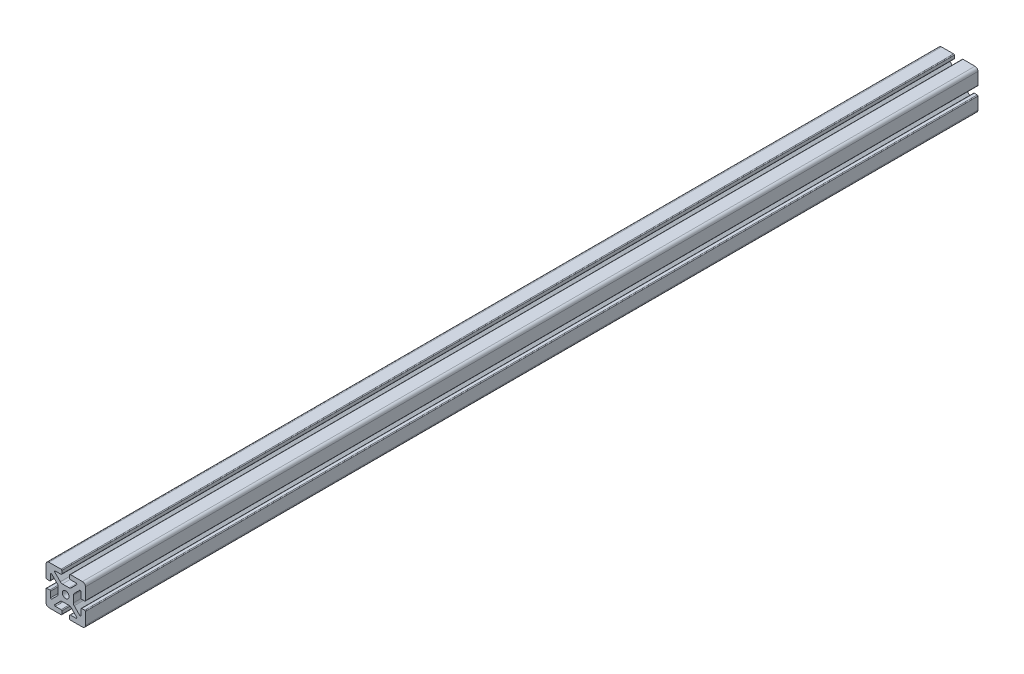
from build123d import *

# Parameters (mm, degrees)
SKETCH1_R          = 3.4036
EXTRUDE1_DEPTH     = 635
CUT_EXTRUDE1_REACH = 638.389
SKETCH4_W          = 58.501723951
SKETCH4_H          = 389.38319937
SKETCH5_W          = 40
SKETCH5_H          = 364.5
CUT_EXTRUDE2_DEPTH = 3.048


with BuildPart() as part:
    # Sketch1 → Extrude1 (new, symmetric)
    with BuildSketch(Plane.XY):
        with BuildLine():
            Line((-20, 16.952), (-20, 4.7625))
            ThreePointArc((-20, 4.7625), (-19.776815367, 4.223684633), (-19.238, 4.0005))
            Line((-19.238, 4.0005), (-16.2662, 4.0005))
            ThreePointArc((-16.2662, 4.0005), (-15.727384633, 4.223684633), (-15.5042, 4.7625))
            Line((-15.5042, 4.7625), (-15.5042, 10.485558599))
            ThreePointArc((-15.5042, 10.485558599), (-15.033804775, 11.189554802), (-14.203384633, 11.024373966))
            Line((-14.203384633, 11.024373966), (-8.635059555, 5.456048889))
            ThreePointArc((-8.635059555, 5.456048889), (-7.985348265, 4.483687227), (-7.7572, 3.336708444))
            Line((-7.7572, 3.336708444), (-7.7572, -3.336708444))
            ThreePointArc((-7.7572, -3.336708444), (-7.985348265, -4.483687227), (-8.635059555, -5.456048889))
            Line((-8.635059555, -5.456048889), (-14.203384633, -11.024373966))
            ThreePointArc((-14.203384633, -11.024373966), (-15.033804775, -11.189554802), (-15.5042, -10.485558599))
            Line((-15.5042, -10.485558599), (-15.5042, -4.7625))
            ThreePointArc((-15.5042, -4.7625), (-15.727384633, -4.223684633), (-16.2662, -4.0005))
            Line((-16.2662, -4.0005), (-19.238, -4.0005))
            ThreePointArc((-19.238, -4.0005), (-19.776815367, -4.223684633), (-20, -4.7625))
            Line((-20, -4.7625), (-20, -16.952))
            ThreePointArc((-20, -16.952), (-19.107261469, -19.107261469), (-16.952, -20))
            Line((-16.952, -20), (-4.7625, -20))
            ThreePointArc((-4.7625, -20), (-4.223684633, -19.776815367), (-4.0005, -19.238))
            Line((-4.0005, -19.238), (-4.0005, -16.2662))
            ThreePointArc((-4.0005, -16.2662), (-4.223684633, -15.727384633), (-4.7625, -15.5042))
            Line((-4.7625, -15.5042), (-10.485558599, -15.5042))
            ThreePointArc((-10.485558599, -15.5042), (-11.189554802, -15.033804775), (-11.024373966, -14.203384633))
            Line((-11.024373966, -14.203384633), (-5.456048889, -8.635059555))
            ThreePointArc((-5.456048889, -8.635059555), (-4.483687227, -7.985348265), (-3.336708444, -7.7572))
            Line((-3.336708444, -7.7572), (3.336708444, -7.7572))
            ThreePointArc((3.336708444, -7.7572), (4.483687227, -7.985348265), (5.456048889, -8.635059555))
            Line((5.456048889, -8.635059555), (11.024373966, -14.203384633))
            ThreePointArc((11.024373966, -14.203384633), (11.189554802, -15.033804775), (10.485558599, -15.5042))
            Line((10.485558599, -15.5042), (4.7625, -15.5042))
            ThreePointArc((4.7625, -15.5042), (4.223684633, -15.727384633), (4.0005, -16.2662))
            Line((4.0005, -16.2662), (4.0005, -19.238))
            ThreePointArc((4.0005, -19.238), (4.223684633, -19.776815367), (4.7625, -20))
            Line((4.7625, -20), (16.952, -20))
            ThreePointArc((16.952, -20), (19.107261469, -19.107261469), (20, -16.952))
            Line((20, -16.952), (20, -4.7625))
            ThreePointArc((20, -4.7625), (19.776815367, -4.223684633), (19.238, -4.0005))
            Line((19.238, -4.0005), (16.2662, -4.0005))
            ThreePointArc((16.2662, -4.0005), (15.727384633, -4.223684633), (15.5042, -4.7625))
            Line((15.5042, -4.7625), (15.5042, -10.485558599))
            ThreePointArc((15.5042, -10.485558599), (15.033804775, -11.189554802), (14.203384633, -11.024373966))
            Line((14.203384633, -11.024373966), (8.635059555, -5.456048889))
            ThreePointArc((8.635059555, -5.456048889), (7.985348265, -4.483687227), (7.7572, -3.336708444))
            Line((7.7572, -3.336708444), (7.7572, 3.336708444))
            ThreePointArc((7.7572, 3.336708444), (7.985348265, 4.483687227), (8.635059555, 5.456048889))
            Line((8.635059555, 5.456048889), (14.203384633, 11.024373966))
            ThreePointArc((14.203384633, 11.024373966), (15.033804775, 11.189554802), (15.5042, 10.485558599))
            Line((15.5042, 10.485558599), (15.5042, 4.7625))
            ThreePointArc((15.5042, 4.7625), (15.727384633, 4.223684633), (16.2662, 4.0005))
            Line((16.2662, 4.0005), (19.238, 4.0005))
            ThreePointArc((19.238, 4.0005), (19.776815367, 4.223684633), (20, 4.7625))
            Line((20, 4.7625), (20, 16.952))
            ThreePointArc((20, 16.952), (19.107261469, 19.107261469), (16.952, 20))
            Line((16.952, 20), (4.7625, 20))
            ThreePointArc((4.7625, 20), (4.223684633, 19.776815367), (4.0005, 19.238))
            Line((4.0005, 19.238), (4.0005, 16.2662))
            ThreePointArc((4.0005, 16.2662), (4.223684633, 15.727384633), (4.7625, 15.5042))
            Line((4.7625, 15.5042), (10.485558599, 15.5042))
            ThreePointArc((10.485558599, 15.5042), (11.189554802, 15.033804775), (11.024373966, 14.203384633))
            Line((11.024373966, 14.203384633), (5.456048889, 8.635059555))
            ThreePointArc((5.456048889, 8.635059555), (4.483687227, 7.985348265), (3.336708444, 7.7572))
            Line((3.336708444, 7.7572), (-3.336708444, 7.7572))
            ThreePointArc((-3.336708444, 7.7572), (-4.483687227, 7.985348265), (-5.456048889, 8.635059555))
            Line((-5.456048889, 8.635059555), (-11.024373966, 14.203384633))
            ThreePointArc((-11.024373966, 14.203384633), (-11.189554802, 15.033804775), (-10.485558599, 15.5042))
            Line((-10.485558599, 15.5042), (-4.7625, 15.5042))
            ThreePointArc((-4.7625, 15.5042), (-4.223684633, 15.727384633), (-4.0005, 16.2662))
            Line((-4.0005, 16.2662), (-4.0005, 19.238))
            ThreePointArc((-4.0005, 19.238), (-4.223684633, 19.776815367), (-4.7625, 20))
            Line((-4.7625, 20), (-16.952, 20))
            ThreePointArc((-16.952, 20), (-19.107261469, 19.107261469), (-20, 16.952))
        make_face()
        with Locations(Location((0, 0, 0), (0, 0, 180))):
            Circle(SKETCH1_R, mode=Mode.SUBTRACT)
    extrude(amount=EXTRUDE1_DEPTH, both=True)

    # Cut-Extrude1: up to this face of the body (flat: up to its plane)
    cut_extrude1_end = Plane(part.part.faces().sort_by_distance((10.85725, -20, 0))[0])
    # Sketch4 → Cut-Extrude1 (cut, up to the picked face)
    with BuildSketch(Plane(origin=(0, 16.952, 0), x_dir=(1, 0, 0), z_dir=(0, 1, 0)), mode=Mode.PRIVATE) as cut_extrude1_sk1:
        with Locations((5.781251025, 465.191599685)):
            Rectangle(SKETCH4_W, SKETCH4_H)
    cut_extrude1_tool1 = split(extrude(cut_extrude1_sk1.sketch, amount=-CUT_EXTRUDE1_REACH, mode=Mode.PRIVATE), bisect_by=cut_extrude1_end, keep=Keep.BOTH, mode=Mode.PRIVATE)
    add(cut_extrude1_tool1.solids().sort_by(Axis((5.781251, 16.952, -465.1916), (0, -1, 0)))[0], mode=Mode.SUBTRACT)

    # Sketch5 → Cut-Extrude2 (cut)
    with BuildSketch(Plane.XZ.offset(-16.952)):
        with Locations((0, -452.75)):
            Rectangle(SKETCH5_W, SKETCH5_H)
    extrude(amount=-CUT_EXTRUDE2_DEPTH, mode=Mode.SUBTRACT)


solid = part.part
